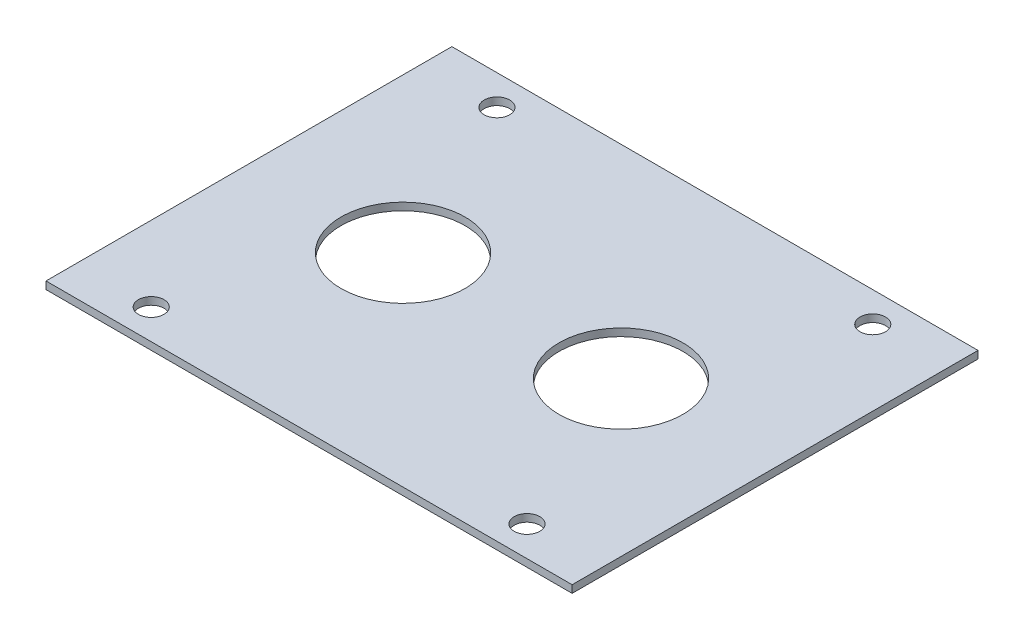
from build123d import *

# Parameters (mm, degrees)
ESQUISSE1_W             = 70
ESQUISSE1_H             = 54
BOSS_EXTRU_1_DEPTH      = 1
ESQUISSE2_R             = 8.25
ENL_V_MAT_EXTRU_1_DEPTH = 10
ESQUISSE4_R             = 8.25
ENL_V_MAT_EXTRU_3_DEPTH = 10
M3_CLEARANCE_HOLE1_D    = 3.4


with BuildPart() as part:
    # Esquisse1 → Boss.-Extru.1 (new body)
    with BuildSketch(Plane(origin=(0, 0, 0), x_dir=(1, 0, 0), z_dir=(0, 1, 0))):
        Rectangle(ESQUISSE1_W, ESQUISSE1_H)
    extrude(amount=BOSS_EXTRU_1_DEPTH)

    # Esquisse2 → Enlèv. mat.-Extru.1 (cut)
    with BuildSketch(Plane(origin=(0, 1, 0), x_dir=(1, 0, 0), z_dir=(0, 1, 0))):
        with Locations(Location((-14.5, 0, 0), (0, 0, 270))):
            Circle(ESQUISSE2_R)
    extrude(amount=-ENL_V_MAT_EXTRU_1_DEPTH, mode=Mode.SUBTRACT)

    # Esquisse4 → Enlèv. mat.-Extru.3 (cut)
    with BuildSketch(Plane(origin=(0, 1, 0), x_dir=(1, 0, 0), z_dir=(0, 1, 0))):
        with Locations(Location((14.5, 0, 0), (0, 0, 270))):
            Circle(ESQUISSE4_R)
    extrude(amount=-ENL_V_MAT_EXTRU_3_DEPTH, mode=Mode.SUBTRACT)

    # M3 Clearance Hole1 (through all)
    with Locations(Plane(origin=(0, 1, 0), x_dir=(1, 0, 0), z_dir=(0, 1, 0))):
        with Locations((-25, -23), (25, -23), (25, 23), (-25, 23)):
            Hole(M3_CLEARANCE_HOLE1_D / 2)


solid = part.part
